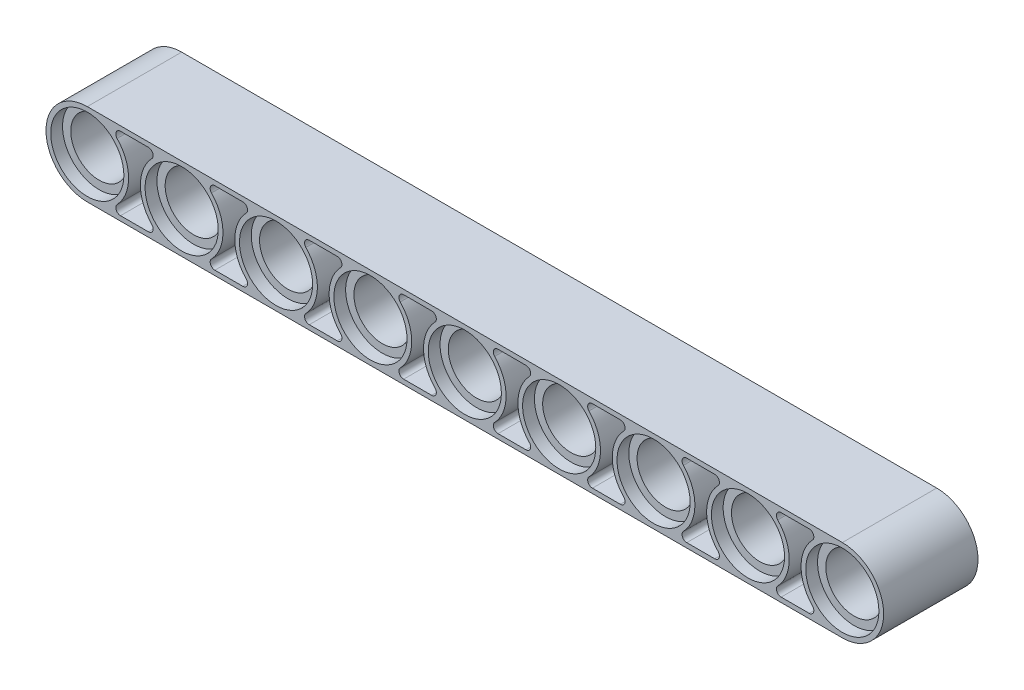
from build123d import *

# Parameters (mm, degrees)
BOSS_EXTRUDE2_DEPTH = 8
SKETCH5_R           = 3.1
CUT_EXTRUDE4_DEPTH  = 1
CUT_EXTRUDE5_START  = -1
SKETCH6_R           = 3.1
CUT_EXTRUDE5_DEPTH  = 1
SKETCH7_R           = 2.4
CUT_EXTRUDE6_DEPTH  = 68.952189074
LPATTERN1_COUNT     = 9
LPATTERN1_PITCH     = 8
CUT_EXTRUDE7_DEPTH  = 69.062471304
LPATTERN2_COUNT     = 8
LPATTERN2_PITCH     = 8


with BuildPart() as part:
    # Sketch1 → Boss-Extrude2 (new body)
    with BuildSketch(Plane.XY):
        with BuildLine():
            Line((0, -3.5), (-64, -3.5))
            ThreePointArc((-64, -3.5), (-67.5, 0), (-64, 3.5))
            Line((-64, 3.5), (0, 3.5))
            ThreePointArc((0, 3.5), (3.5, 0), (0, -3.5))
        make_face()
    extrude(amount=BOSS_EXTRUDE2_DEPTH)

    # Sketch5 → Cut-Extrude4 (cut)
    with BuildSketch(Plane(origin=(0, 0, 0), x_dir=(-1, 0, 0), z_dir=(0, 0, -1))):
        Circle(SKETCH5_R)
    cut_extrude4 = extrude(amount=-CUT_EXTRUDE4_DEPTH, mode=Mode.SUBTRACT)

    # Sketch6 → Cut-Extrude5 (cut)
    with BuildSketch(Plane.XY.offset(8).offset(CUT_EXTRUDE5_START)):
        with Locations(Location((0, 0, 0), (0, 0, 180))):
            Circle(SKETCH6_R)
    cut_extrude5 = extrude(amount=CUT_EXTRUDE5_DEPTH, mode=Mode.SUBTRACT)

    # Sketch7 → Cut-Extrude6 (cut, symmetric)
    with BuildSketch(Plane.XY.offset(7)):
        Circle(SKETCH7_R)
    cut_extrude6 = extrude(amount=CUT_EXTRUDE6_DEPTH, both=True, mode=Mode.SUBTRACT)

    # LPattern1: Cut-Extrude4, Cut-Extrude5, Cut-Extrude6 ×9
    with Locations(*[(-i * LPATTERN1_PITCH, 0, 0) for i in range(1, LPATTERN1_COUNT)]):
        add(cut_extrude4, mode=Mode.SUBTRACT)
        add(cut_extrude5, mode=Mode.SUBTRACT)
        add(cut_extrude6, mode=Mode.SUBTRACT)

    # Sketch8 → Cut-Extrude7 (cut, through all)
    with BuildSketch(Plane(origin=(0, 0, 0), x_dir=(-1, 0, 0), z_dir=(0, 0, -1))):
        with BuildLine():
            Line((2.814249456, 3.1), (5.185750544, 3.1))
            ThreePointArc((5.185750544, 3.1), (5.553697029, 2.856892908), (5.474391514, 2.423076923))
            ThreePointArc((5.474391514, 2.423076923), (4.5, 0), (5.474391514, -2.423076923))
            ThreePointArc((5.474391514, -2.423076923), (5.553697029, -2.856892908), (5.185750544, -3.1))
            Line((5.185750544, -3.1), (2.814249456, -3.1))
            ThreePointArc((2.814249456, -3.1), (2.446302971, -2.856892908), (2.525608486, -2.423076923))
            ThreePointArc((2.525608486, -2.423076923), (3.5, 0), (2.525608486, 2.423076923))
            ThreePointArc((2.525608486, 2.423076923), (2.446302971, 2.856892908), (2.814249456, 3.1))
        make_face()
    cut_extrude7 = extrude(amount=-CUT_EXTRUDE7_DEPTH, mode=Mode.SUBTRACT)

    # LPattern2: Cut-Extrude7 ×8
    with Locations(*[(-i * LPATTERN2_PITCH, 0, 0) for i in range(1, LPATTERN2_COUNT)]):
        add(cut_extrude7, mode=Mode.SUBTRACT)


solid = part.part
